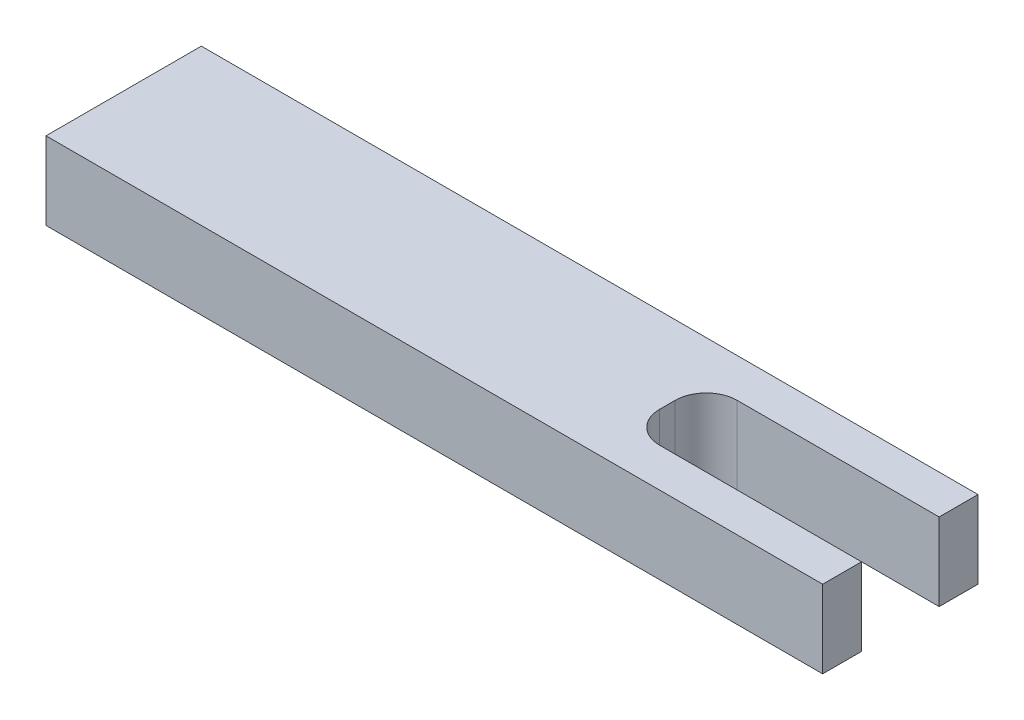
from build123d import *

# Parameters (mm, degrees)
CROQUIS1_W              = 50
CROQUIS1_H              = 10
SALIENTE_EXTRUIR1_DEPTH = 2.5
CORTAR_EXTRUIR1_DEPTH   = 52.23475383


with BuildPart() as part:
    # Croquis1 → Saliente-Extruir1 (new, symmetric)
    with BuildSketch(Plane(origin=(0, 0, 0), x_dir=(1, 0, 0), z_dir=(0, 1, 0))):
        with Locations((25, 5)):
            Rectangle(CROQUIS1_W, CROQUIS1_H)
    extrude(amount=SALIENTE_EXTRUIR1_DEPTH, both=True)

    # Croquis2 → Cortar-Extruir1 (cut, through all)
    with BuildSketch(Plane(origin=(0, 2.5, 0), x_dir=(1, 0, 0), z_dir=(0, 1, 0))):
        with BuildLine():
            Line((50, 7.5), (37, 7.5))
            ThreePointArc((37, 7.5), (35.585786438, 6.914213562), (35, 5.5))
            Line((35, 5.5), (35, 4.5))
            ThreePointArc((35, 4.5), (35.585786438, 3.085786438), (37, 2.5))
            Line((37, 2.5), (50, 2.5))
            Line((50, 2.5), (50, 7.5))
        make_face()
    extrude(amount=-CORTAR_EXTRUIR1_DEPTH, mode=Mode.SUBTRACT)


solid = part.part
